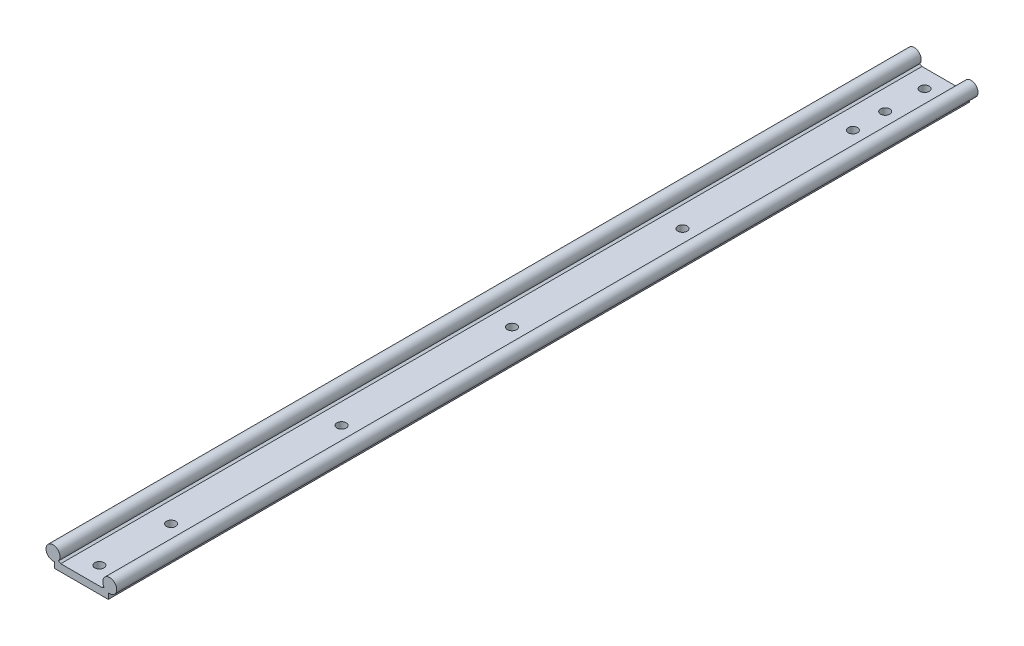
from build123d import *

# Parameters (mm, degrees)
BOSS_EXTRUDE1_DEPTH = 304.8
SKETCH2_R           = 3.2766
CUT_EXTRUDE2_DEPTH  = 306.95635975
SKETCH4_R           = 3.2766
CUT_EXTRUDE4_DEPTH  = 25.4
SKETCH5_R           = 3.2766
CUT_EXTRUDE5_DEPTH  = 25.4
SKETCH6_R           = 3.2766
CUT_EXTRUDE8_DEPTH  = 25.4


with BuildPart() as part:
    # Sketch1 → Boss-Extrude1 (new, symmetric)
    with BuildSketch(Plane.XY):
        with BuildLine():
            Line((-14.605, 5.08), (14.605, 5.08))
            Line((14.605, 5.08), (16.174141854, 5.985944472))
            ThreePointArc((16.174141854, 5.985944472), (22.730946929, 13.208062038), (19.05, 4.174717993))
            Line((19.05, 4.174717993), (19.05, 0))
            Line((19.05, 0), (-19.05, 0))
            Line((-19.05, 0), (-19.05, 4.174717993))
            ThreePointArc((-19.05, 4.174717993), (-22.730946929, 13.208062038), (-16.174141854, 5.985944472))
            Line((-16.174141854, 5.985944472), (-14.605, 5.08))
        make_face()
    extrude(amount=BOSS_EXTRUDE1_DEPTH, both=True)

    # Sketch2 → Cut-Extrude2 (cut, through all)
    with BuildSketch(Plane(origin=(0, 5.08, 0), x_dir=(1, 0, 0), z_dir=(0, 1, 0))):
        with Locations(Location((0, -292.1, 0), (0, 0, 270))):
            Circle(SKETCH2_R)
    extrude(amount=-CUT_EXTRUDE2_DEPTH, mode=Mode.SUBTRACT)

    # Sketch4 → Cut-Extrude4 (cut)
    with BuildSketch(Plane(origin=(0, 5.08, 0), x_dir=(1, 0, 0), z_dir=(0, 1, 0))):
        with Locations(Location((0, -241.3, 0), (0, 0, 270))):
            Circle(SKETCH4_R)
        with Locations(Location((0, -120.65, 0), (0, 0, 270))):
            Circle(SKETCH4_R)
        with Locations(Location((0, 0, 0), (0, 0, 270))):
            Circle(SKETCH4_R)
        with Locations(Location((0, 120.65, 0), (0, 0, 270))):
            Circle(SKETCH4_R)
        with Locations(Location((0, 241.3, 0), (0, 0, 270))):
            Circle(SKETCH4_R)
    extrude(amount=-CUT_EXTRUDE4_DEPTH, mode=Mode.SUBTRACT)

    # Sketch5 → Cut-Extrude5 (cut)
    with BuildSketch(Plane(origin=(0, 5.08, 0), x_dir=(1, 0, 0), z_dir=(0, 1, 0))):
        with Locations(Location((0, 292.1, 0), (0, 0, 270))):
            Circle(SKETCH5_R)
    extrude(amount=-CUT_EXTRUDE5_DEPTH, mode=Mode.SUBTRACT)

    # Sketch6 → Cut-Extrude8 (cut)
    with BuildSketch(Plane(origin=(0, 5.08, 0), x_dir=(1, 0, 0), z_dir=(0, 1, 0))):
        with Locations(Location((0, 264.16, 0), (0, 0, 270))):
            Circle(SKETCH6_R)
    extrude(amount=-CUT_EXTRUDE8_DEPTH, mode=Mode.SUBTRACT)


solid = part.part
